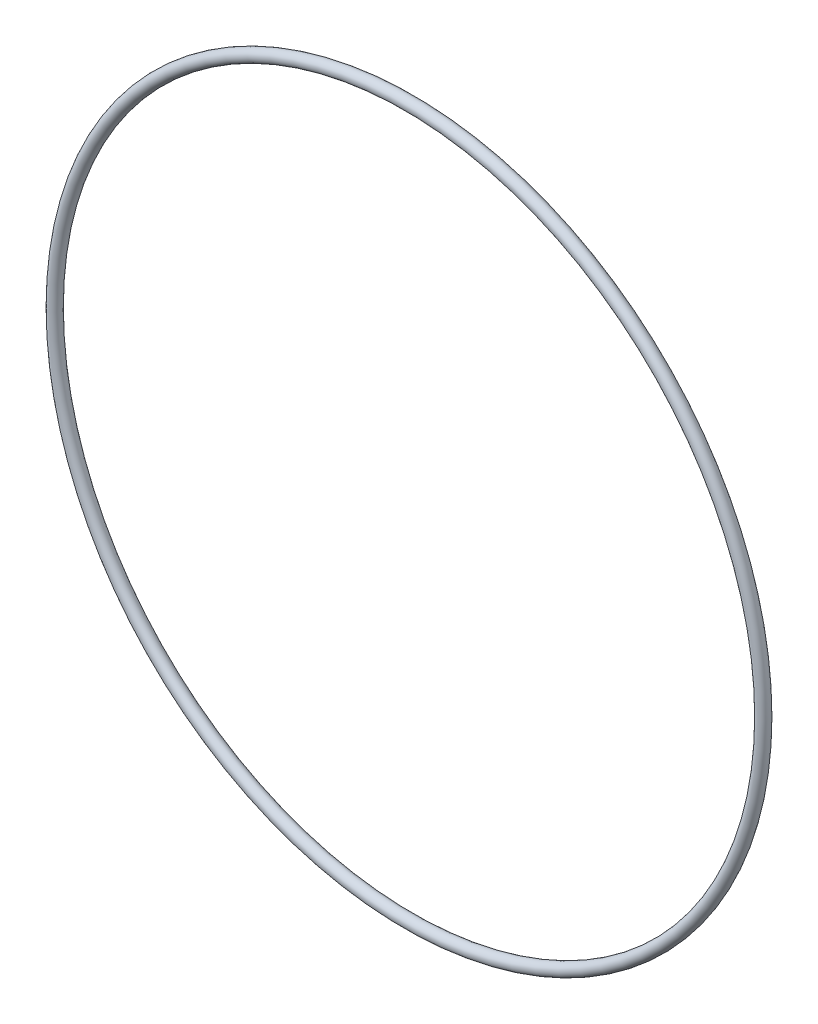
from build123d import *

# Parameters (mm, degrees)
SKETCH1_R = 0.889


with BuildPart() as part:
    # Sketch1 → Revolve1 (revolve)
    with BuildSketch(Plane(origin=(0, 0, 0), x_dir=(0, -1, 0), z_dir=(1, 0, 0)), mode=Mode.PRIVATE) as revolve1_sk:
        with Locations((51.5493, 0)):
            Circle(SKETCH1_R)
    revolve(revolve1_sk.sketch.rotate(Axis((0, 0, 0.889), (0, 0, -1)), 270), axis=Axis((0, 0, 0.889), (0, 0, -1)))


solid = part.part
